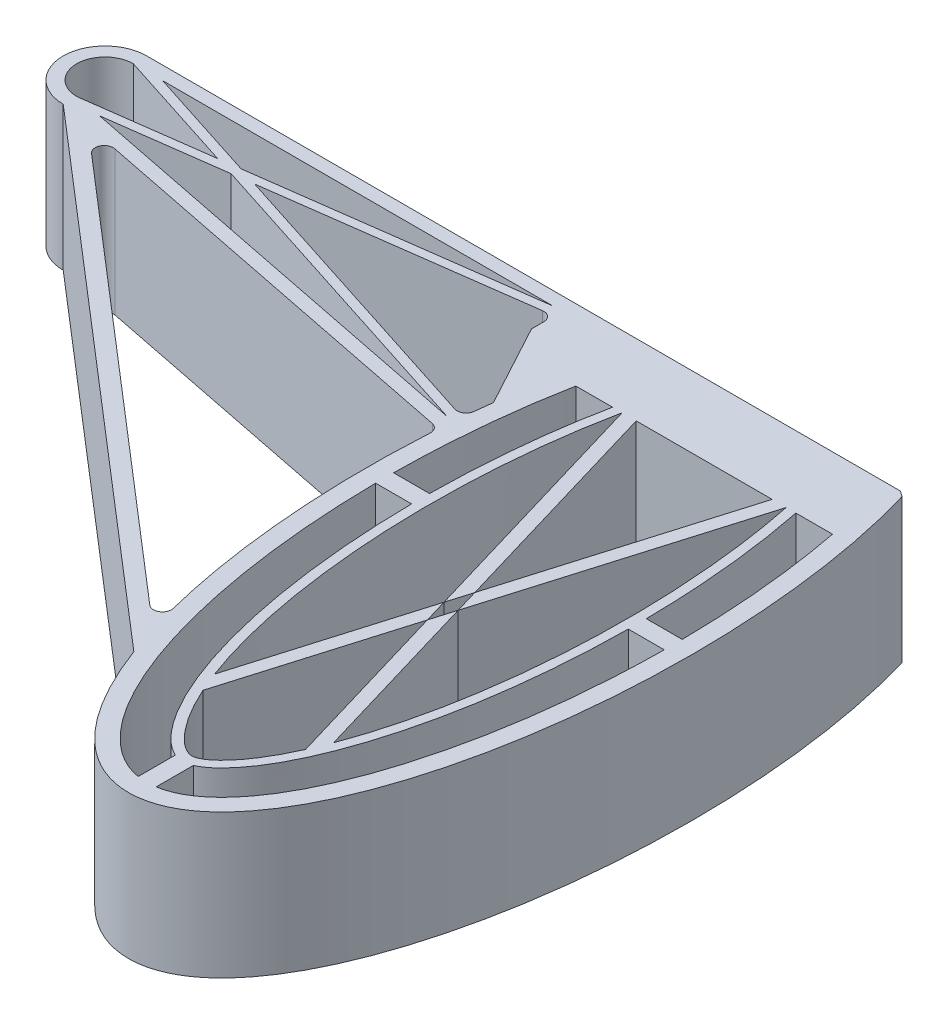
from build123d import *

# Parameters (mm, degrees)
BOSS_EXTRUDE1_DEPTH = 16
BOSS_EXTRUDE2_DEPTH = 16
BOSS_EXTRUDE3_DEPTH = 16
BOSS_EXTRUDE4_DEPTH = 16
SKETCH9_W           = 40
SKETCH9_H           = 24
CUT_EXTRUDE4_DEPTH  = 22
SKETCH25_R          = 1.25
CUT_EXTRUDE12_DEPTH = 4
SKETCH23_R          = 1.25
CUT_EXTRUDE13_DEPTH = 4
SKETCH24_R          = 1.25
CUT_EXTRUDE14_DEPTH = 3
BOSS_EXTRUDE5_DEPTH = 16
BOSS_EXTRUDE6_DEPTH = 16
SKETCH10_R          = 1
CUT_EXTRUDE5_DEPTH  = 14
CUT_EXTRUDE15_DEPTH = 9
SKETCH29_R          = 1
CUT_EXTRUDE16_DEPTH = 12
FILLET1_R           = 1


with BuildPart() as part:
    # Sketch1 → Boss-Extrude1 (new body)
    with BuildSketch(Plane(origin=(0, 0, 0), x_dir=(1, 0, 0), z_dir=(0, 1, 0))):
        with BuildLine():
            Line((0, 0), (0, -1.370526213))
            Line((0, -1.370526213), (-4.257744064, -4.437196595))
            add(Edge.make_bspline(
                [(-4.257744064, -4.437196595), (-4.502691757, -5.256633093), (-4.954383697, -6.883392156), (-5.782550999, -10.343670153), (-6.633990879, -14.904009628), (-7.357399252, -20.692157262), (-7.904756341, -28.674189668), (-7.788402639, -38.875434181), (-6.374993684, -50.562842935), (-3.780113753, -60.835361347), (-0.759598491, -67.612587129), (2.128148554, -71.70837272), (4.548190426, -74.065562813), (7.262501719, -75.621626405), (10.25, -76.189186798), (13.237498281, -75.621626405), (15.951809575, -74.065562813), (18.371851447, -71.70837272), (21.259598492, -67.612587128), (24.280113753, -60.835361347), (26.874993684, -50.562842934), (28.28840264, -38.87543418), (28.404756341, -28.674189668), (27.857399252, -20.692157261), (27.133990879, -14.904009627), (26.282550999, -10.343670152), (25.454383697, -6.883392155), (25.002691757, -5.256633093), (24.757744064, -4.437196595)],
                knots=[-2.240685274, -2.240685274, -2.240685274, -2.240685274, -2.17066386, -2.100642445, -1.960599615, -1.820556785, -1.680513956, -1.400428296, -1.120342637, -0.840256978, -0.560171319, -0.420128489, -0.280085659, -0.14004283, 0, 0.14004283, 0.280085659, 0.420128489, 0.560171319, 0.840256978, 1.120342637, 1.400428296, 1.680513956, 1.820556785, 1.960599615, 2.100642445, 2.17066386, 2.240685274, 2.240685274, 2.240685274, 2.240685274], degree=3))
            Line((24.757744064, -4.437196595), (20.5, -1.370526213))
            Line((20.5, -1.370526213), (20.5, 0))
            Line((20.5, 0), (16.5, 0))
            Line((16.5, 0), (16.5, -4))
            Line((16.5, -4), (4, -4))
            Line((4, -4), (4, 0))
            Line((4, 0), (0, 0))
        make_face()
        with BuildLine():
            Line((-2.75, -6.437196595), (23.25, -6.437196595))
            add(Edge.make_bspline(
                [(-2.75, -6.437196595), (-21.25501839, -74), (10.25, -74), (41.75501839, -74), (23.25, -6.437196595)],
                knots=[4.084586939, 4.084586939, 4.084586939, 6.283185307, 6.283185307, 8.481783676, 8.481783676, 8.481783676], degree=2, weights=[1, 0.454220582, 1, 0.454220582, 1]))
        make_face(mode=Mode.SUBTRACT)
    extrude(amount=BOSS_EXTRUDE1_DEPTH)

    # Sketch4 → Boss-Extrude2 (add)
    with BuildSketch(Plane(origin=(0, 16, 0), x_dir=(1, 0, 0), z_dir=(0, 1, 0))):
        with BuildLine():
            Line((24.000704622, -9.437196595), (-3.500704622, -9.437196595))
            add(Edge.make_bspline(
                [(-3.500704622, -9.437196595), (-3.78018184, -10.663685094), (-4.027900282, -11.937196595)],
                knots=[4.169182878, 4.169182878, 4.169182878, 4.236480106, 4.236480106, 4.236480106], degree=2, weights=[1, 0.999433939, 1]))
            Line((-4.027900282, -11.937196595), (-0.970025558, -11.937196595))
            Line((-0.970025558, -11.937196595), (13.964140864, -11.937196595))
            Line((13.964140864, -11.937196595), (15.124869395, -11.937196595))
            Line((15.124869395, -11.937196595), (21.469998047, -11.937196595))
            Line((21.469998047, -11.937196595), (24.527900282, -11.937196595))
            add(Edge.make_bspline(
                [(24.527900282, -11.937196595), (24.28018184, -10.663685094), (24.000704622, -9.437196595)],
                knots=[2.046705202, 2.046705202, 2.046705202, 2.114002429, 2.114002429, 2.114002429], degree=2, weights=[1, 0.999433939, 1]))
        make_face()
    extrude(amount=-BOSS_EXTRUDE2_DEPTH)

    # Sketch5 → Boss-Extrude3 (add)
    with BuildSketch(Plane(origin=(0, 16, 0), x_dir=(1, 0, 0), z_dir=(0, 1, 0))):
        with BuildLine():
            add(Edge.make_bspline(
                [(-1.608424276, -30.437196595), (-1.619611068, -31.103668087), (-1.61967472, -31.770333643), (-1.608424276, -32.437196595)],
                knots=[0.190744117, 0.190744117, 0.190744117, 0.190744117, 0.208396529, 0.208396529, 0.208396529, 0.208396529], degree=3))
            Line((-1.608424276, -30.437196595), (-1.807876391, -30.437196595))
            add(Edge.make_bspline(
                [(-1.807876391, -30.437196595), (-1.813940107, -31.103690976), (-1.813900605, -31.770660251), (-1.807768348, -32.437196595)],
                knots=[0.144049127, 0.144049127, 0.144049127, 0.144049127, 0.154919209, 0.154919209, 0.154919209, 0.154919209], degree=3))
            Line((-1.807768348, -32.437196595), (-1.608424276, -32.437196595))
        make_face()
        with BuildLine():
            Line((-1.807876391, -30.437196595), (-1.608424276, -30.437196595))
            add(Edge.make_bspline(
                [(-1.608424276, -30.437196595), (-1.619611068, -31.103668087), (-1.61967472, -31.770333643), (-1.608424276, -32.437196595)],
                knots=[0.190744117, 0.190744117, 0.190744117, 0.190744117, 0.208396529, 0.208396529, 0.208396529, 0.208396529], degree=3))
            Line((-1.608424276, -32.437196595), (-1.807768348, -32.437196595))
            add(Edge.make_bspline(
                [(-1.807768348, -32.437196595), (-1.789388193, -34.434999523), (-1.716272251, -36.4289131), (-1.343983644, -42.165079283), (-0.898077823, -45.839341341), (0.346876684, -52.659985034), (1.148610045, -55.814277325), (2.539301489, -59.929712099), (3.033767625, -61.19859966), (4.064563561, -63.500134075), (4.601101045, -64.532580437), (5.684075645, -66.332273168), (6.227868525, -67.094482279), (7.280417204, -68.340557688), (7.780467879, -68.814167582), (8.461212451, -69.333011167), (8.674242477, -69.472567343), (9.004847349, -69.659425489), (9.131539116, -69.72194754), (9.25, -69.773015091)],
                knots=[0.154919209, 0.154919209, 0.154919209, 0.154919209, 0.1875, 0.1875, 0.25, 0.25, 0.3125, 0.3125, 0.34375, 0.34375, 0.375, 0.375, 0.40625, 0.40625, 0.4375, 0.4375, 0.453125, 0.453125, 0.46396315, 0.46396315, 0.46396315, 0.46396315], degree=3))
            Line((9.25, -69.773015091), (9.25, -69.717438801))
            add(Edge.make_bspline(
                [(9.25, -69.717438801), (9.315593579, -69.729498649), (9.381443278, -69.740423705), (9.744226149, -69.79399534), (10.049003109, -69.814068253), (10.64971774, -69.803069524), (10.946917103, -69.772686626), (11.244110839, -69.718519431), (11.247055464, -69.717980316), (11.25, -69.717438801)],
                knots=[0.490446512, 0.490446512, 0.490446512, 0.490446512, 0.4921875, 0.4921875, 0.5, 0.5, 0.5078125, 0.5078125, 0.507890684, 0.507890684, 0.507890684, 0.507890684], degree=3))
            Line((11.25, -69.717438801), (11.25, -69.773015091))
            add(Edge.make_bspline(
                [(11.25, -69.773015091), (11.368460884, -69.72194754), (11.495152652, -69.659425489), (11.825757523, -69.472567343), (12.038787549, -69.333011167), (12.719532121, -68.814167582), (13.219582797, -68.340557688), (14.272131475, -67.094482279), (14.815924355, -66.332273168), (15.898898955, -64.532580436), (16.43543644, -63.500134074), (17.466232375, -61.19859966), (17.960698511, -59.929712099), (19.351389955, -55.814277324), (20.153123316, -52.659985033), (21.398077823, -45.839341341), (21.843983644, -42.165079283), (22.216272251, -36.428913099), (22.289388193, -34.434999523), (22.307768348, -32.437196595)],
                knots=[0.53603685, 0.53603685, 0.53603685, 0.53603685, 0.546875, 0.546875, 0.5625, 0.5625, 0.59375, 0.59375, 0.625, 0.625, 0.65625, 0.65625, 0.6875, 0.6875, 0.75, 0.75, 0.8125, 0.8125, 0.845080791, 0.845080791, 0.845080791, 0.845080791], degree=3))
            Line((22.307768348, -32.437196595), (22.108424276, -32.437196595))
            add(Edge.make_bspline(
                [(22.108424276, -32.437196595), (22.119695454, -31.769452391), (22.119650331, -31.102790038), (22.108424276, -30.437196595)],
                knots=[0.791085814, 0.791085814, 0.791085814, 0.791085814, 0.808681538, 0.808681538, 0.808681538, 0.808681538], degree=3))
            Line((22.108424276, -30.437196595), (22.307876391, -30.437196595))
            add(Edge.make_bspline(
                [(22.307876391, -30.437196595), (22.297250113, -29.269207558), (22.26788065, -28.102676939), (22.06166982, -23.135930047), (21.699868558, -19.390973641), (20.945979085, -14.52647439), (20.710270678, -13.21185597), (20.449124772, -11.937196595)],
                knots=[0.855950873, 0.855950873, 0.855950873, 0.855950873, 0.875, 0.875, 0.9375, 0.9375, 0.961484455, 0.961484455, 0.961484455, 0.961484455], degree=3))
            Line((20.449124772, -11.937196595), (19.377002413, -11.937196595))
            add(Edge.make_bspline(
                [(16.867383437, -59.793597718), (17.058943161, -59.287454336), (17.246571447, -58.763158668), (18.337495295, -55.534817861), (19.128163997, -52.42775466), (20.357168692, -45.694494072), (20.798659176, -42.059001665), (21.283154269, -34.593975027), (21.327100461, -30.75510805), (21.014130546, -23.216986247), (20.655798524, -19.510117544), (19.899279436, -14.628650611), (19.651937101, -13.260035708), (19.377002413, -11.937196595)],
                knots=[0.674906638, 0.674906638, 0.674906638, 0.674906638, 0.6875, 0.6875, 0.75, 0.75, 0.8125, 0.8125, 0.875, 0.875, 0.9375, 0.9375, 0.962826996, 0.962826996, 0.962826996, 0.962826996], degree=3))
            add(Edge.make_bspline(
                [(15.956682934, -62), (15.96865042, -61.973462611), (15.980608092, -61.946855666), (16.291176533, -61.253426512), (16.58359423, -60.543431901), (16.867383437, -59.793597718)],
                knots=[0.655503561, 0.655503561, 0.655503561, 0.655503561, 0.65625, 0.65625, 0.674906638, 0.674906638, 0.674906638, 0.674906638], degree=3))
            add(Edge.make_bspline(
                [(4.543317066, -62), (5.032373999, -63.084462839), (5.537820077, -64.052767242), (6.559040753, -65.749836986), (7.071658453, -66.466242071), (8.040895108, -67.613687302), (8.487285543, -68.032676172), (9.062532464, -68.471112536), (9.235821046, -68.583864307), (9.536368312, -68.753733869), (9.663303314, -68.81098681), (9.874020239, -68.889467775), (9.969747255, -68.914904632), (10.132107878, -68.945098766), (10.198533056, -68.95), (10.301466944, -68.95), (10.367892122, -68.945098766), (10.530252745, -68.914904632), (10.625979761, -68.889467775), (10.836696686, -68.81098681), (10.963631688, -68.753733869), (11.264178954, -68.583864307), (11.437467536, -68.471112536), (12.012714457, -68.032676172), (12.459104892, -67.613687302), (13.428341547, -66.466242071), (13.940959248, -65.749836986), (14.962179923, -64.052767242), (15.467626001, -63.084462839), (15.956682934, -62)],
                knots=[0.344496439, 0.344496439, 0.344496439, 0.344496439, 0.375, 0.375, 0.40625, 0.40625, 0.4375, 0.4375, 0.453125, 0.453125, 0.46875, 0.46875, 0.484375, 0.484375, 0.5, 0.5, 0.515625, 0.515625, 0.53125, 0.53125, 0.546875, 0.546875, 0.5625, 0.5625, 0.59375, 0.59375, 0.625, 0.625, 0.655503561, 0.655503561, 0.655503561, 0.655503561], degree=3))
            add(Edge.make_bspline(
                [(3.632616563, -59.793597718), (3.91640577, -60.543431901), (4.208823468, -61.253426512), (4.519391908, -61.946855666), (4.53134958, -61.973462611), (4.543317066, -62)],
                knots=[0.325093362, 0.325093362, 0.325093362, 0.325093362, 0.34375, 0.34375, 0.344496439, 0.344496439, 0.344496439, 0.344496439], degree=3))
            add(Edge.make_bspline(
                [(1.122997587, -11.937196595), (0.848062899, -13.260035708), (0.600720564, -14.628650611), (-0.155798524, -19.510117545), (-0.514130546, -23.216986247), (-0.827100461, -30.755108051), (-0.783154269, -34.593975028), (-0.298659176, -42.059001666), (0.142831308, -45.694494073), (1.371836003, -52.42775466), (2.162504705, -55.534817862), (3.253428553, -58.763158669), (3.441056839, -59.287454336), (3.632616563, -59.793597718)],
                knots=[0.037173004, 0.037173004, 0.037173004, 0.037173004, 0.0625, 0.0625, 0.125, 0.125, 0.1875, 0.1875, 0.25, 0.25, 0.3125, 0.3125, 0.325093362, 0.325093362, 0.325093362, 0.325093362], degree=3))
            Line((1.122997587, -11.937196595), (0.050875228, -11.937196595))
            add(Edge.make_bspline(
                [(0.050875228, -11.937196595), (-0.210270679, -13.21185597), (-0.445979085, -14.526474391), (-1.199868558, -19.390973642), (-1.56166982, -23.135930047), (-1.76788065, -28.10267694), (-1.797250113, -29.269207559), (-1.807876391, -30.437196595)],
                knots=[0.038515545, 0.038515545, 0.038515545, 0.038515545, 0.0625, 0.0625, 0.125, 0.125, 0.144049127, 0.144049127, 0.144049127, 0.144049127], degree=3))
        make_face()
        with BuildLine():
            add(Edge.make_bspline(
                [(-1.807876391, -30.437196595), (-1.813940107, -31.103690976), (-1.813900605, -31.770660251), (-1.807768348, -32.437196595)],
                knots=[0.144049127, 0.144049127, 0.144049127, 0.144049127, 0.154919209, 0.154919209, 0.154919209, 0.154919209], degree=3))
            Line((-1.807876391, -30.437196595), (-5.808424276, -30.437196595))
            add(Edge.make_bspline(
                [(-5.808424276, -30.437196595), (-5.817293432, -31.437196595), (-5.808424276, -32.437196595)],
                knots=[4.688892125, 4.688892125, 4.688892125, 4.735885835, 4.735885835, 4.735885835], degree=2, weights=[1, 0.999723962, 1]))
            Line((-5.808424276, -32.437196595), (-1.807768348, -32.437196595))
        make_face()
        with BuildLine():
            Line((2.687458467, -11.937196595), (1.122997587, -11.937196595))
            Line((1.122997587, -11.937196595), (9.46776956, -40.100304344))
            Line((9.46776956, -40.100304344), (3.632616563, -59.793597718))
            add(Edge.make_bspline(
                [(3.632616563, -59.793597718), (3.91640577, -60.543431901), (4.208823468, -61.253426512), (4.519391908, -61.946855666), (4.53134958, -61.973462611), (4.543317066, -62)],
                knots=[0.325093362, 0.325093362, 0.325093362, 0.325093362, 0.34375, 0.34375, 0.344496439, 0.344496439, 0.344496439, 0.344496439], degree=3))
            Line((4.543317066, -62), (10.25, -42.740285429))
            Line((10.25, -42.740285429), (15.956682934, -62))
            add(Edge.make_bspline(
                [(15.956682934, -62), (15.96865042, -61.973462611), (15.980608092, -61.946855666), (16.291176533, -61.253426512), (16.58359423, -60.543431901), (16.867383437, -59.793597718)],
                knots=[0.655503561, 0.655503561, 0.655503561, 0.655503561, 0.65625, 0.65625, 0.674906638, 0.674906638, 0.674906638, 0.674906638], degree=3))
            Line((16.867383437, -59.793597718), (11.03223044, -40.100304344))
            Line((11.03223044, -40.100304344), (19.377002413, -11.937196595))
            Line((19.377002413, -11.937196595), (17.812541533, -11.937196595))
            Line((17.812541533, -11.937196595), (10.25, -37.460323259))
            Line((10.25, -37.460323259), (2.687458467, -11.937196595))
        make_face()
        with BuildLine():
            add(Edge.make_bspline(
                [(9.25, -69.773015091), (9.302320225, -69.795569926), (9.353034857, -69.815890338), (9.56261905, -69.89394942), (9.7165513, -69.935820516), (10.001350762, -69.988784548), (10.132040587, -70), (10.367959413, -70), (10.498649238, -69.988784548), (10.7834487, -69.935820516), (10.93738095, -69.89394942), (11.146965144, -69.815890338), (11.197679775, -69.795569926), (11.25, -69.773015091)],
                knots=[0.46396315, 0.46396315, 0.46396315, 0.46396315, 0.46875, 0.46875, 0.484375, 0.484375, 0.5, 0.5, 0.515625, 0.515625, 0.53125, 0.53125, 0.53603685, 0.53603685, 0.53603685, 0.53603685], degree=3))
            Line((9.25, -69.773015091), (9.25, -73.917438801))
            add(Edge.make_bspline(
                [(9.25, -73.917438801), (10.25, -74.082721658), (11.25, -73.917438801)],
                knots=[6.220889602, 6.220889602, 6.220889602, 6.345481013, 6.345481013, 6.345481013], degree=2, weights=[1, 0.99806025, 1]))
            Line((11.25, -73.917438801), (11.25, -69.773015091))
        make_face()
        with BuildLine():
            Line((9.25, -69.717438801), (9.25, -69.773015091))
            add(Edge.make_bspline(
                [(9.25, -69.773015091), (9.302320225, -69.795569926), (9.353034857, -69.815890338), (9.56261905, -69.89394942), (9.7165513, -69.935820516), (10.001350762, -69.988784548), (10.132040587, -70), (10.367959413, -70), (10.498649238, -69.988784548), (10.7834487, -69.935820516), (10.93738095, -69.89394942), (11.146965144, -69.815890338), (11.197679775, -69.795569926), (11.25, -69.773015091)],
                knots=[0.46396315, 0.46396315, 0.46396315, 0.46396315, 0.46875, 0.46875, 0.484375, 0.484375, 0.5, 0.5, 0.515625, 0.515625, 0.53125, 0.53125, 0.53603685, 0.53603685, 0.53603685, 0.53603685], degree=3))
            Line((11.25, -69.773015091), (11.25, -69.717438801))
            add(Edge.make_bspline(
                [(9.25, -69.717438801), (9.315593579, -69.729498649), (9.381443278, -69.740423705), (9.744226149, -69.79399534), (10.049003109, -69.814068253), (10.64971774, -69.803069524), (10.946917103, -69.772686626), (11.244110839, -69.718519431), (11.247055464, -69.717980316), (11.25, -69.717438801)],
                knots=[0.490446512, 0.490446512, 0.490446512, 0.490446512, 0.4921875, 0.4921875, 0.5, 0.5, 0.5078125, 0.5078125, 0.507890684, 0.507890684, 0.507890684, 0.507890684], degree=3))
        make_face()
        with BuildLine():
            add(Edge.make_bspline(
                [(22.307768348, -32.437196595), (22.313900605, -31.770660251), (22.313940107, -31.103690976), (22.307876391, -30.437196595)],
                knots=[0.845080791, 0.845080791, 0.845080791, 0.845080791, 0.855950873, 0.855950873, 0.855950873, 0.855950873], degree=3))
            Line((22.307768348, -32.437196595), (26.308424276, -32.437196595))
            add(Edge.make_bspline(
                [(26.308424276, -32.437196595), (26.317293432, -31.437196595), (26.308424276, -30.437196595)],
                knots=[7.791293784, 7.791293784, 7.791293784, 7.835892212, 7.835892212, 7.835892212], degree=2, weights=[0.764849854, 0.768966994, 0.773533288]))
            Line((26.308424276, -30.437196595), (22.307876391, -30.437196595))
        make_face()
        with BuildLine():
            Line((22.108424276, -32.437196595), (22.307768348, -32.437196595))
            add(Edge.make_bspline(
                [(22.307768348, -32.437196595), (22.313900605, -31.770660251), (22.313940107, -31.103690976), (22.307876391, -30.437196595)],
                knots=[0.845080791, 0.845080791, 0.845080791, 0.845080791, 0.855950873, 0.855950873, 0.855950873, 0.855950873], degree=3))
            Line((22.307876391, -30.437196595), (22.108424276, -30.437196595))
            add(Edge.make_bspline(
                [(22.108424276, -32.437196595), (22.119695454, -31.769452391), (22.119650331, -31.102790038), (22.108424276, -30.437196595)],
                knots=[0.791085814, 0.791085814, 0.791085814, 0.791085814, 0.808681538, 0.808681538, 0.808681538, 0.808681538], degree=3))
        make_face()
    extrude(amount=-BOSS_EXTRUDE3_DEPTH)

    # Sketch7 → Boss-Extrude4 (add)
    with BuildSketch(Plane(origin=(0, 16, 0), x_dir=(1, 0, 0), z_dir=(0, 1, 0))):
        with BuildLine():
            Line((-2.75, -6.437196595), (23.25, -6.437196595))
            add(Edge.make_bspline(
                [(24.000704622, -9.437196595), (23.649310969, -7.895102117), (23.25, -6.437196595)],
                knots=[2.114002429, 2.114002429, 2.114002429, 2.198598368, 2.198598368, 2.198598368], degree=2, weights=[1, 0.999105574, 1]))
            Line((24.000704622, -9.437196595), (-3.500704622, -9.437196595))
            add(Edge.make_bspline(
                [(-2.75, -6.437196595), (-3.149310969, -7.895102117), (-3.500704622, -9.437196595)],
                knots=[4.084586939, 4.084586939, 4.084586939, 4.169182878, 4.169182878, 4.169182878], degree=2, weights=[1, 0.999105574, 1]))
        make_face()
    extrude(amount=-BOSS_EXTRUDE4_DEPTH)

    # Sketch9 → Cut-Extrude4 (cut)
    with BuildSketch(Plane(origin=(0, 16, 0), x_dir=(1, 0, 0), z_dir=(0, 1, 0))):
        with Locations((12, 8)):
            Rectangle(SKETCH9_W, SKETCH9_H)
    extrude(amount=-CUT_EXTRUDE4_DEPTH, mode=Mode.SUBTRACT)

    # Sketch25 → Cut-Extrude12 (cut)
    with BuildSketch(Plane(origin=(0, 0, 30.437196595), x_dir=(-1, 0, 0), z_dir=(0, 0, -1))):
        with Locations((-24.308150334, 8)):
            Circle(SKETCH25_R)
    extrude(amount=-CUT_EXTRUDE12_DEPTH, mode=Mode.SUBTRACT)

    # Sketch23 → Cut-Extrude13 (cut)
    with BuildSketch(Plane(origin=(0, 0, 30.437196595), x_dir=(-1, 0, 0), z_dir=(0, 0, -1))):
        with Locations((3.808150334, 8)):
            Circle(SKETCH23_R)
    extrude(amount=-CUT_EXTRUDE13_DEPTH, mode=Mode.SUBTRACT)

    # Sketch24 → Cut-Extrude14 (cut)
    with BuildSketch(Plane.ZY.offset(-9.25)):
        with Locations((71.845226945, 8)):
            Circle(SKETCH24_R)
    extrude(amount=-CUT_EXTRUDE14_DEPTH, mode=Mode.SUBTRACT)

    # Sketch26 → Boss-Extrude5 (add)
    with BuildSketch(Plane(origin=(0, 16, 0), x_dir=(1, 0, 0), z_dir=(0, 1, 0))):
        Polygon((-3.650743319, -4), (-12.004812364, -4), (-12.004812364, -8.896583234), (-7.020166814, -18.110149417), align=None)
    extrude(amount=-BOSS_EXTRUDE5_DEPTH)

    # Sketch27 → Boss-Extrude6 (add)
    with BuildSketch(Plane(origin=(0, 16, 0), x_dir=(1, 0, 0), z_dir=(0, 1, 0))):
        with BuildLine():
            Line((-12.004812364, -4), (-59.70668831, -4))
            ThreePointArc((-59.70668831, -4), (-64.355881824, -8.649193515), (-59.70668831, -13.298387029))
            Line((-59.70668831, -13.298387029), (-3.023664492, -62.12267215))
            Line((-3.023664492, -62.12267215), (-1.899388724, -60.817433374))
            Line((-1.899388724, -60.817433374), (-56.271270611, -13.983865137))
            Line((-56.271270611, -13.983865137), (-7.25690416, -23.763833142))
            Line((-7.25690416, -23.763833142), (-7.25690416, -22.234264607))
            Line((-7.25690416, -22.234264607), (-6.985768406, -21.390473318))
            Line((-6.985768406, -21.390473318), (-34.721359768, -12.478185892))
            Line((-34.721359768, -12.478185892), (-41.365574951, -10.343197867))
            Line((-41.365574951, -10.343197867), (-34.721359768, -9.444964183))
            Line((-34.721359768, -9.444964183), (-12.004812364, -6.373906501))
            Line((-12.004812364, -6.373906501), (-12.004812364, -4))
        make_face()
        with BuildLine():
            Line((-45.876773413, -9.943971467), (-59.572775147, -11.795538546))
            ThreePointArc((-59.572775147, -11.795538546), (-62.855169623, -8.716165242), (-59.70668831, -5.5))
            Line((-59.70668831, -5.5), (-45.876773413, -9.943971467))
        make_face(mode=Mode.SUBTRACT)
        Polygon((-13.004812364, -5.5), (-34.721359768, -8.435867345), (-43.57598262, -9.632926786), (-56.437907172, -5.5), align=None, mode=Mode.SUBTRACT)
        Polygon((-43.666365745, -10.654242548), (-34.721359768, -13.528544496), (-8.237572869, -22.038589149), (-56.558053178, -12.397074107), align=None, mode=Mode.SUBTRACT)
    extrude(amount=-BOSS_EXTRUDE6_DEPTH)

    # Sketch10 → Cut-Extrude5 (cut)
    with BuildSketch(Plane(origin=(0, 0, 4), x_dir=(-1, 0, 0), z_dir=(0, 0, -1))):
        with Locations((-22.5, 8)):
            Circle(SKETCH10_R)
        with Locations((9.5, 8)):
            Circle(SKETCH10_R)
    extrude(amount=-CUT_EXTRUDE5_DEPTH, mode=Mode.SUBTRACT)

    # Sketch28 → Cut-Extrude15 (cut)
    with BuildSketch(Plane(origin=(-78.643593284, 0, 10), x_dir=(-1, 0, 0), z_dir=(0, 0, -1))):
        Polygon((-70.298293822, 10), (-67.988892746, 10), (-66.834192207, 8), (-67.988892746, 6), (-70.298293822, 6), (-71.452994361, 8), align=None)
    extrude(amount=-CUT_EXTRUDE15_DEPTH, mode=Mode.SUBTRACT)

    # Sketch29 → Cut-Extrude16 (cut)
    with BuildSketch(Plane.ZY.offset(58.004812364)):
        with Locations(Location((8.649193515, 8, 0), (0, 0, 180))):
            Circle(SKETCH29_R)
    extrude(amount=CUT_EXTRUDE16_DEPTH, mode=Mode.SUBTRACT)

    # Fillet1
    fillet1_edges = [part.edges().sort_by_distance(p)[0] for p in [
        (-7.550417347, 8, 23.705267669),
        (-7.356422588, 8, 21.271370878),
        (-12.004812364, 8, 6.373906501),
        (-56.271270611, 8, 13.983865137),
        (-4.11425309, 8, 58.909645786),
    ]]
    fillet(fillet1_edges, radius=FILLET1_R)


solid = part.part
